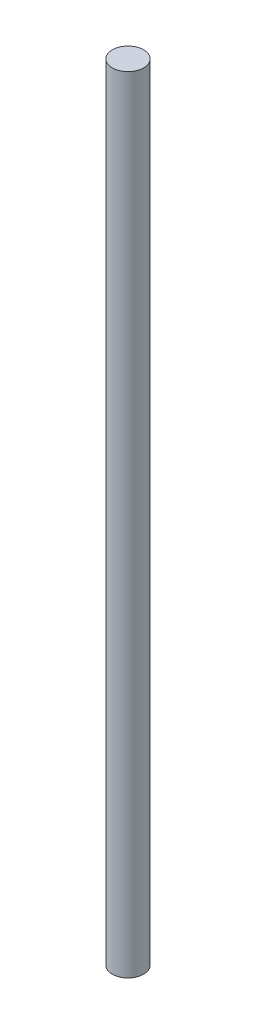
from build123d import *

# Parameters (mm, degrees)
SKETCH_1_R      = 2
EXTRUDE_1_DEPTH = 100


with BuildPart() as part:
    # ｽｹｯﾁ1 → ﾎﾞｽ - 押し出し1 (new body)
    with BuildSketch(Plane(origin=(0, 0, 0), x_dir=(1, 0, 0), z_dir=(0, 1, 0))):
        with Locations(Location((0, 0, 0), (0, 0, 270))):
            Circle(SKETCH_1_R)
    extrude(amount=EXTRUDE_1_DEPTH)


solid = part.part
